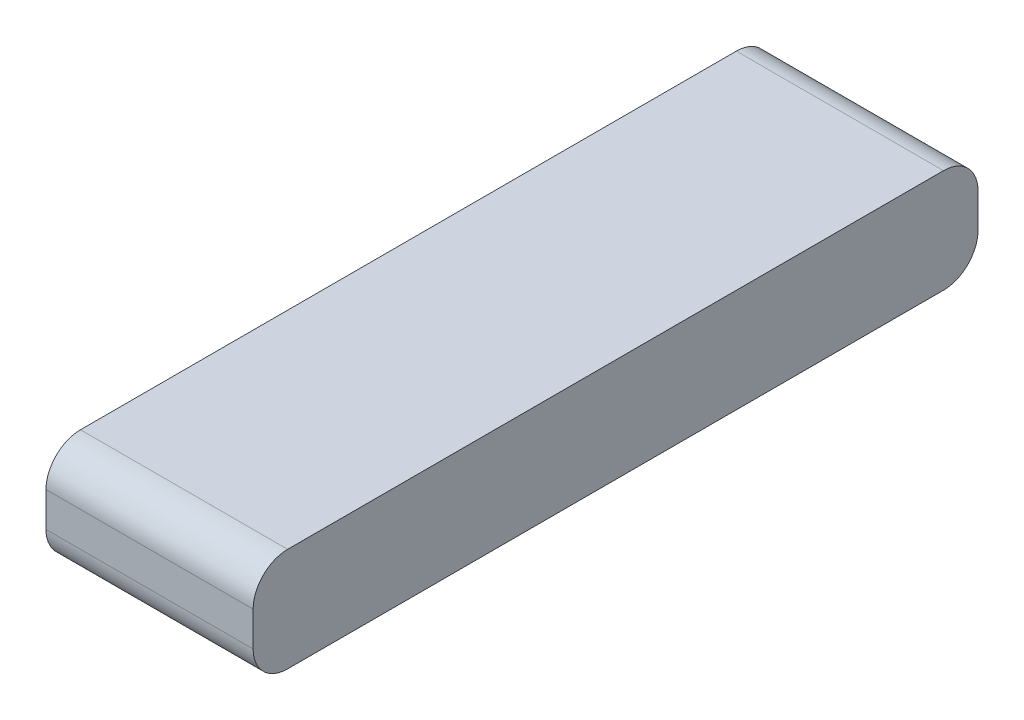
from build123d import *

# Parameters (mm, degrees)
SKETCH1_W           = 38.1
SKETCH1_H           = 133.35
BOSS_EXTRUDE1_DEPTH = 19.05
FILLET1_R           = 6.35


with BuildPart() as part:
    # Sketch1 → Boss-Extrude1 (new body)
    with BuildSketch(Plane(origin=(0, 0, 0), x_dir=(1, 0, 0), z_dir=(0, 1, 0))):
        with Locations((19.05, 66.675)):
            Rectangle(SKETCH1_W, SKETCH1_H)
    extrude(amount=BOSS_EXTRUDE1_DEPTH)

    # Fillet1
    fillet1_edges = [part.edges().sort_by_distance(p)[0] for p in [
        (19.05, 19.05, -133.35),
        (19.05, 0, -133.35),
        (19.05, 0, 0),
        (19.05, 19.05, 0),
    ]]
    fillet(fillet1_edges, radius=FILLET1_R)


solid = part.part
